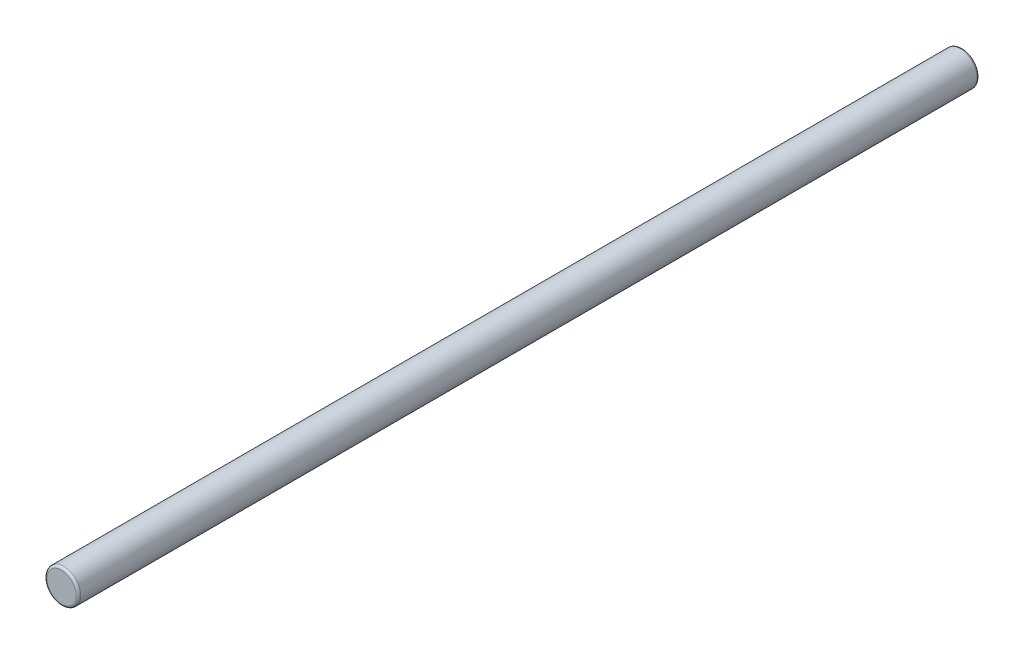
from build123d import *

# Parameters (mm, degrees)
SKETCH1_R           = 0.75
BOSS_EXTRUDE1_DEPTH = 40
FILLET1_R           = 0.1
FILLET2_R           = 0.1


with BuildPart() as part:
    # Sketch1 → Boss-Extrude1 (new body)
    with BuildSketch(Plane.XY):
        Circle(SKETCH1_R)
    extrude(amount=BOSS_EXTRUDE1_DEPTH)

    # Fillet1
    fillet1_edges = [part.edges().sort_by_distance(p)[0] for p in [
        (-0.75, 0, 40),
    ]]
    fillet(fillet1_edges, radius=FILLET1_R)

    # Fillet2
    fillet2_edges = [part.edges().sort_by_distance(p)[0] for p in [
        (-0.75, 0, 0),
    ]]
    fillet(fillet2_edges, radius=FILLET2_R)


solid = part.part
